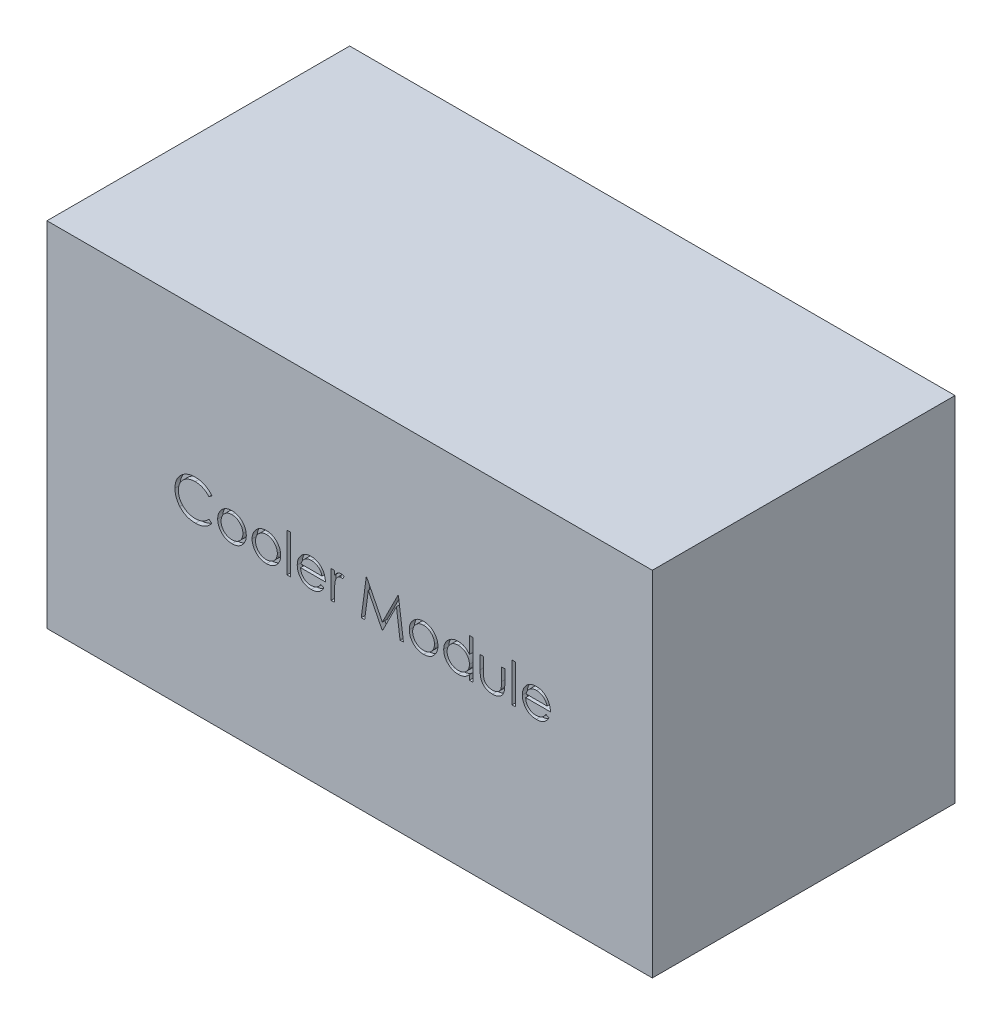
from build123d import *

# Parameters (mm, degrees)
SKETCH1_W           = 304.8
SKETCH1_H           = 177.8
BOSS_EXTRUDE1_DEPTH = 76.2
SKETCH2_W           = 1.709615385
SKETCH2_H           = 19.538461538
CUT_EXTRUDE1_DEPTH  = 2.54


with BuildPart() as part:
    # Sketch1 → Boss-Extrude1 (new, symmetric)
    with BuildSketch(Plane.XY):
        Rectangle(SKETCH1_W, SKETCH1_H)
    extrude(amount=BOSS_EXTRUDE1_DEPTH, both=True)

    # Sketch2 → Cut-Extrude1 (cut)
    # profile 1 of 12: a face of its own
    with BuildSketch(Plane.XY.offset(76.2)):
        with BuildLine():
            Line((-69.387672667, 10.444990481), (-70.883586129, 9.30015875))
            add(Edge.make_bspline(
                [(-70.883586129, 9.30015875), (-70.990298178, 9.427336386), (-71.202283568, 9.679977027), (-71.543328656, 10.034739977), (-71.898756169, 10.367109471), (-72.268430243, 10.678668844), (-72.659004879, 10.958522955), (-73.061018655, 11.221255672), (-73.481196587, 11.456755789), (-74.062231028, 11.742304328), (-74.822314316, 12.040279828), (-75.779140512, 12.290124559), (-76.777965205, 12.449171244), (-77.459397855, 12.466397024), (-77.806001994, 12.47515875)],
                knots=[0, 0, 0, 0, 0.757959112, 1.505699292, 2.245454638, 2.979532153, 3.711538275, 4.438200793, 5.171680507, 5.909471876, 7.393775596, 8.890124382, 10.418191784, 12, 12, 12, 12], degree=3))
            add(Edge.make_bspline(
                [(-77.806001994, 12.47515875), (-77.996955381, 12.47296004), (-78.377089926, 12.468583026), (-78.94123376, 12.410839073), (-79.494843367, 12.329679487), (-80.037558633, 12.209254513), (-80.568688736, 12.057003544), (-81.091705953, 11.875073791), (-81.599037932, 11.649985305), (-82.097702914, 11.401201776), (-82.57547262, 11.12020097), (-83.02752938, 10.81369544), (-83.452224463, 10.485115072), (-83.849893823, 10.133228336), (-84.220943999, 9.759619951), (-84.562686362, 9.360308321), (-84.873938381, 8.936570062), (-85.160869617, 8.493992801), (-85.41784178, 8.033865678), (-85.632997266, 7.554485651), (-85.823525146, 7.064061891), (-85.974288167, 6.55705343), (-86.09362018, 6.037027804), (-86.17595789, 5.502589373), (-86.23304514, 4.954854631), (-86.237400389, 4.583601086), (-86.239595744, 4.396462837)],
                knots=[0, 0, 0, 0, 1.054917814, 2.100044995, 3.131103042, 4.146048494, 5.169673617, 6.183595914, 7.203665975, 8.234915748, 9.262203917, 10.264457458, 11.251630812, 12.227803204, 13.197192746, 14.159520551, 15.12972552, 16.100847026, 17.073214652, 18.039054194, 19.002613845, 19.979014051, 20.95965708, 21.949030935, 22.966165397, 24, 24, 24, 24], degree=3))
            add(Edge.make_bspline(
                [(-86.239595744, 4.396462837), (-86.232727844, 4.114896653), (-86.219243632, 3.562078798), (-86.099237699, 2.752341618), (-85.916874274, 1.97662195), (-85.643558062, 1.239768809), (-85.306541515, 0.532696174), (-84.880689044, -0.132632442), (-84.387476176, -0.766271172), (-83.819925408, -1.35324493), (-83.197230895, -1.889441064), (-82.529131548, -2.361612086), (-81.817291353, -2.755211661), (-81.06956998, -3.082740741), (-80.28021356, -3.334509501), (-79.450641564, -3.511751374), (-78.582658275, -3.627369528), (-77.989553399, -3.638438601), (-77.687702715, -3.644072019)],
                knots=[0, 0, 0, 0, 1.029171465, 2.020641659, 2.987623507, 3.938342917, 4.889210282, 5.84687017, 6.821220943, 7.821438502, 8.827599549, 9.822697543, 10.807740252, 11.797342354, 12.80366471, 13.83203677, 14.896651826, 16, 16, 16, 16], degree=3))
            add(Edge.make_bspline(
                [(-77.687702715, -3.644072019), (-77.355129508, -3.634880232), (-76.700545878, -3.616788596), (-75.740599906, -3.463521826), (-74.821650953, -3.215012302), (-73.94364959, -2.867225039), (-73.109071015, -2.415112544), (-72.316609193, -1.867028382), (-71.565595216, -1.217759028), (-71.11399438, -0.722006573), (-70.883586129, -0.469072019)],
                knots=[0, 0, 0, 0, 1.028121516, 2.023589091, 2.998037872, 3.967518031, 4.937445131, 5.927275754, 6.942489185, 8, 8, 8, 8], degree=3))
            Line((-70.883586129, -0.469072019), (-69.387672667, -1.602455432))
            add(Edge.make_bspline(
                [(-69.387672667, -1.602455432), (-69.50805838, -1.757786149), (-69.748253164, -2.067703558), (-70.137188942, -2.504611006), (-70.546912518, -2.915568685), (-70.980467168, -3.297263309), (-71.432865434, -3.657332615), (-71.912230448, -3.985546868), (-72.412260468, -4.286487253), (-72.931261274, -4.56204237), (-73.468681438, -4.806520529), (-74.023877006, -5.015818894), (-74.594454852, -5.196112935), (-75.180441062, -5.344441334), (-75.78305111, -5.460216805), (-76.400110405, -5.537612463), (-77.032950726, -5.590636312), (-77.459896175, -5.595469111), (-77.676254398, -5.597918173)],
                knots=[0, 0, 0, 0, 0.986787822, 1.968848986, 2.935600012, 3.899624008, 4.868462664, 5.837806735, 6.815139263, 7.798259679, 8.787526145, 9.778297419, 10.776456485, 11.791383307, 12.812564526, 13.85620153, 14.913611965, 16, 16, 16, 16], degree=3))
            add(Edge.make_bspline(
                [(-77.676254398, -5.597918173), (-77.8811435, -5.596492185), (-78.286286328, -5.59367247), (-78.884449533, -5.547995102), (-79.466778537, -5.485675819), (-80.031609001, -5.391840249), (-80.582023236, -5.281108912), (-81.113031561, -5.132675358), (-81.629859205, -4.966400609), (-82.130429746, -4.770974895), (-82.615168969, -4.550451102), (-83.082513428, -4.301214188), (-83.532248181, -4.025360039), (-83.968794829, -3.728969197), (-84.385704534, -3.402521311), (-84.786590151, -3.050550057), (-85.173699629, -2.674241742), (-85.413199957, -2.402888897), (-85.533616177, -2.266457836)],
                knots=[0, 0, 0, 0, 1.114604814, 2.203992996, 3.262667896, 4.300477797, 5.318619304, 6.316056647, 7.298880507, 8.271930387, 9.238335007, 10.195173496, 11.151986948, 12.108099108, 13.064862484, 14.031167946, 15.010108607, 16, 16, 16, 16], degree=3))
            add(Edge.make_bspline(
                [(-85.533616177, -2.266457836), (-85.726487322, -2.029469365), (-86.109901103, -1.558353556), (-86.600442324, -0.794797001), (-87.020345446, 0.002408536), (-87.359848672, 0.837451292), (-87.625257262, 1.708457499), (-87.809123481, 2.615866228), (-87.928602928, 3.558830027), (-87.942266072, 4.200198834), (-87.949211129, 4.526210433)],
                knots=[0, 0, 0, 0, 0.994628077, 1.977248131, 2.950237994, 3.925870899, 4.908910175, 5.911660606, 6.938484602, 8, 8, 8, 8], degree=3))
            add(Edge.make_bspline(
                [(-87.949211129, 4.526210433), (-87.940746433, 4.868867973), (-87.924092671, 5.543025291), (-87.78260127, 6.532394951), (-87.554987536, 7.480276136), (-87.231698757, 8.384899375), (-86.821822488, 9.251022757), (-86.315491918, 10.072029886), (-85.71858933, 10.853171324), (-85.03579614, 11.582594471), (-84.287036786, 12.249558661), (-83.485201528, 12.836332428), (-82.631859788, 13.32465205), (-81.736412624, 13.732845449), (-80.792154843, 14.046596027), (-79.801101076, 14.266232657), (-78.765113555, 14.402941533), (-78.058290924, 14.420223736), (-77.699151033, 14.429004904)],
                knots=[0, 0, 0, 0, 1.032925535, 2.032216505, 3.007276963, 3.968222605, 4.92396291, 5.891752235, 6.871517503, 7.883894988, 8.900124299, 9.891468569, 10.874487609, 11.85992873, 12.854644235, 13.869047385, 14.917252991, 16, 16, 16, 16], degree=3))
            add(Edge.make_bspline(
                [(-77.699151033, 14.429004904), (-77.480269407, 14.426380695), (-77.047015272, 14.421186337), (-76.406104406, 14.370534335), (-75.782122598, 14.286095992), (-75.174639968, 14.171164241), (-74.580701156, 14.028521534), (-74.00484556, 13.842700767), (-73.443694135, 13.630230504), (-72.900785964, 13.385527997), (-72.378725884, 13.110844733), (-71.877676493, 12.80922541), (-71.401617762, 12.481043955), (-70.947199887, 12.129091528), (-70.52202451, 11.745922227), (-70.114019891, 11.342075312), (-69.737041737, 10.905918355), (-69.504342204, 10.598914357), (-69.387672667, 10.444990481)],
                knots=[0, 0, 0, 0, 1.096760587, 2.17092713, 3.219439832, 4.250915756, 5.268269357, 6.278326846, 7.281116186, 8.274029601, 9.260640565, 10.235837813, 11.203064059, 12.156899882, 13.114053108, 14.069676657, 15.032185724, 16, 16, 16, 16], degree=3))
        make_face()
    # profile 2 of 12: a face of its own
    with BuildSketch(Plane.XY.offset(76.2)):
        with BuildLine():
            add(Edge.make_bspline(
                [(-59.244463533, 9.055927981), (-58.983253891, 9.050365974), (-58.471085619, 9.039460236), (-57.721016983, 8.922901637), (-57.0050356, 8.744662411), (-56.320399325, 8.498255766), (-55.675876346, 8.167972578), (-55.062078574, 7.773859151), (-54.480688855, 7.306956749), (-54.132220653, 6.945779262), (-53.955340937, 6.762448414)],
                knots=[0, 0, 0, 0, 1.054011418, 2.066658804, 3.057071809, 4.030435133, 4.997543892, 5.974964718, 6.972108034, 8, 8, 8, 8], degree=3))
            add(Edge.make_bspline(
                [(-53.955340937, 6.762448414), (-53.803039158, 6.587112291), (-53.50138306, 6.239833283), (-53.114582505, 5.676739161), (-52.781362299, 5.093590899), (-52.514319611, 4.482644735), (-52.303762554, 3.849234025), (-52.154270693, 3.19118165), (-52.06535109, 2.509940875), (-52.053360655, 2.047277128), (-52.047288052, 1.812959231)],
                knots=[0, 0, 0, 0, 1.025258237, 2.030674902, 3.01204498, 3.988269485, 4.97094183, 5.956517959, 6.965070386, 8, 8, 8, 8], degree=3))
            add(Edge.make_bspline(
                [(-52.047288052, 1.812959231), (-52.052629331, 1.577283203), (-52.063183947, 1.11157638), (-52.16302563, 0.425670975), (-52.318316255, -0.239417989), (-52.540558117, -0.880906022), (-52.825535826, -1.500753982), (-53.173283711, -2.096254529), (-53.586242084, -2.668582569), (-54.054349553, -3.212878289), (-54.571703336, -3.714525829), (-55.1329498, -4.151741125), (-55.727059612, -4.52632685), (-56.361932721, -4.828059341), (-57.031771471, -5.065964996), (-57.738020656, -5.233060799), (-58.47958311, -5.334089392), (-58.985916986, -5.347062841), (-59.244463533, -5.353687404)],
                knots=[0, 0, 0, 0, 0.998656419, 1.973391657, 2.932242238, 3.890759089, 4.846373663, 5.82037756, 6.809684879, 7.83454468, 8.860553229, 9.859544525, 10.845671541, 11.83227036, 12.833544569, 13.85385346, 14.904124723, 16, 16, 16, 16], degree=3))
            add(Edge.make_bspline(
                [(-59.244463533, -5.353687404), (-59.504276792, -5.347040607), (-60.013134185, -5.33402252), (-60.757314173, -5.23345331), (-61.464829099, -5.066042005), (-62.135544756, -4.827277509), (-62.773147423, -4.526317206), (-63.370699642, -4.152873581), (-63.93240204, -3.714396165), (-64.449865269, -3.212913422), (-64.917943393, -2.668573517), (-65.330909338, -2.096256879), (-65.678655256, -1.50075337), (-65.96363348, -0.880906185), (-66.185875205, -0.239417945), (-66.341165866, 0.425670963), (-66.44100754, 1.111576383), (-66.451562157, 1.577283204), (-66.456903437, 1.812959231)],
                knots=[0, 0, 0, 0, 1.099876186, 2.154163076, 3.173186993, 4.173200201, 5.163417411, 6.152872554, 7.150605724, 8.17532212, 9.198891216, 10.186952605, 11.159729845, 12.11414092, 13.071450619, 14.029093627, 15.002601286, 16, 16, 16, 16], degree=3))
            add(Edge.make_bspline(
                [(-66.456903437, 1.812959231), (-66.450789419, 2.046003574), (-66.438684714, 2.507391321), (-66.349854515, 3.187351466), (-66.2009458, 3.844290112), (-65.990136343, 4.475255917), (-65.720632232, 5.08352479), (-65.392094365, 5.668113942), (-65.001348208, 6.228661827), (-64.700891872, 6.575492005), (-64.548850552, 6.751000096)],
                knots=[0, 0, 0, 0, 1.031353054, 2.041901799, 3.029428768, 4.008703097, 4.981709435, 5.96992636, 6.972712378, 8, 8, 8, 8], degree=3))
            add(Edge.make_bspline(
                [(-64.548850552, 6.751000096), (-64.372237507, 6.935920837), (-64.024896876, 7.299600012), (-63.440613087, 7.765141322), (-62.828325289, 8.167455953), (-62.17667962, 8.491176497), (-61.492605778, 8.746111857), (-60.77295533, 8.923361304), (-60.020341453, 9.039040279), (-59.505666944, 9.050242647), (-59.244463533, 9.055927981)],
                knots=[0, 0, 0, 0, 1.027980169, 2.021703884, 2.998553061, 3.971491411, 4.943284454, 5.930300938, 6.949603206, 8, 8, 8, 8], degree=3))
        make_face()
        with BuildLine():
            add(Edge.make_bspline(
                [(-59.252095744, 7.346312596), (-59.436813315, 7.341062462), (-59.801480001, 7.330697724), (-60.338252312, 7.2518639), (-60.854998007, 7.126963913), (-61.352697458, 6.949504693), (-61.829672297, 6.7203664), (-62.286379187, 6.438925182), (-62.724161467, 6.108908662), (-63.134455269, 5.730833264), (-63.511004711, 5.317834736), (-63.840177698, 4.877788669), (-64.120077205, 4.417832698), (-64.35325007, 3.93748852), (-64.526916337, 3.431888382), (-64.653043788, 2.906758089), (-64.73180324, 2.361027751), (-64.742070529, 1.990037065), (-64.747288052, 1.801510914)],
                knots=[0, 0, 0, 0, 1.021534396, 2.016698045, 2.994645724, 3.958388632, 4.93408049, 5.916473867, 6.921342795, 7.962252576, 8.998418191, 10.008913653, 10.997312074, 11.973003931, 12.956656626, 13.948281152, 14.957379055, 16, 16, 16, 16], degree=3))
            add(Edge.make_bspline(
                [(-64.747288052, 1.801510914), (-64.738542341, 1.557932023), (-64.721183739, 1.074473473), (-64.580021952, 0.36248722), (-64.343876628, -0.321036861), (-64.024994435, -0.972091762), (-63.625454873, -1.574465161), (-63.154718124, -2.111519955), (-62.617836327, -2.575174157), (-62.021209375, -2.959879902), (-61.377023731, -3.265549429), (-60.695271469, -3.482169569), (-59.984212834, -3.622985494), (-59.498270569, -3.636981662), (-59.252095744, -3.644072019)],
                knots=[0, 0, 0, 0, 1.016792936, 2.018143844, 3.017858371, 4.030088057, 5.03801393, 6.028138512, 7.003788237, 7.991172063, 8.984598303, 9.972568034, 10.972917682, 12, 12, 12, 12], degree=3))
            add(Edge.make_bspline(
                [(-59.252095744, -3.644072019), (-59.005935079, -3.636940351), (-58.520020764, -3.622862635), (-57.809950101, -3.482878774), (-57.130061197, -3.264600278), (-56.486544645, -2.960223678), (-55.890189275, -2.573713249), (-55.349446201, -2.114138111), (-54.88272876, -1.57304272), (-54.483584425, -0.971293885), (-54.159480011, -0.322046197), (-53.924440012, 0.362613374), (-53.782938866, 1.074441345), (-53.76562607, 1.557921259), (-53.756903437, 1.801510914)],
                knots=[0, 0, 0, 0, 1.02726834, 2.027799167, 3.010890988, 4.004497153, 4.992059811, 5.971914811, 6.958719428, 7.966827853, 8.981595046, 9.981490638, 10.983022906, 12, 12, 12, 12], degree=3))
            add(Edge.make_bspline(
                [(-53.756903437, 1.801510914), (-53.762119164, 1.990038192), (-53.772382918, 2.361031095), (-53.851168081, 2.906745306), (-53.977200375, 3.431935282), (-54.151217321, 3.937315472), (-54.383377025, 4.419076388), (-54.668674141, 4.876438188), (-54.996503008, 5.319359103), (-55.377596195, 5.729498205), (-55.787461723, 6.109056047), (-56.225421431, 6.439053152), (-56.6814511, 6.719129493), (-57.157040243, 6.951464603), (-57.654803504, 7.125349412), (-58.170825164, 7.252585078), (-58.705307258, 7.330364577), (-59.068667193, 7.34096259), (-59.252095744, 7.346312596)],
                knots=[0, 0, 0, 0, 1.042956736, 2.052379634, 3.044323526, 4.02829302, 5.004299113, 5.996692471, 7.007513377, 8.048758398, 9.090003419, 10.095195979, 11.07790575, 12.047570684, 13.018257071, 13.989683339, 14.985167495, 16, 16, 16, 16], degree=3))
        make_face(mode=Mode.SUBTRACT)
    # profile 3 of 12: a face of its own
    with BuildSketch(Plane.XY.offset(76.2)):
        with BuildLine():
            add(Edge.make_bspline(
                [(-41.904078917, 9.055927981), (-41.642869275, 9.050365974), (-41.130701003, 9.039460236), (-40.380632367, 8.922901637), (-39.664650985, 8.744662411), (-38.98001471, 8.498255766), (-38.335491731, 8.167972578), (-37.721693959, 7.773859151), (-37.140304239, 7.306956749), (-36.791836037, 6.945779262), (-36.614956321, 6.762448414)],
                knots=[0, 0, 0, 0, 1.054011418, 2.066658804, 3.057071809, 4.030435133, 4.997543892, 5.974964718, 6.972108034, 8, 8, 8, 8], degree=3))
            add(Edge.make_bspline(
                [(-36.614956321, 6.762448414), (-36.462654543, 6.587112291), (-36.160998445, 6.239833283), (-35.774197889, 5.676739161), (-35.440977683, 5.093590899), (-35.173934996, 4.482644735), (-34.963377938, 3.849234025), (-34.813886077, 3.19118165), (-34.724966474, 2.509940875), (-34.71297604, 2.047277128), (-34.706903437, 1.812959231)],
                knots=[0, 0, 0, 0, 1.025258237, 2.030674902, 3.01204498, 3.988269485, 4.97094183, 5.956517959, 6.965070386, 8, 8, 8, 8], degree=3))
            add(Edge.make_bspline(
                [(-34.706903437, 1.812959231), (-34.712244715, 1.577283203), (-34.722799332, 1.11157638), (-34.822641015, 0.425670975), (-34.97793164, -0.239417989), (-35.200173502, -0.880906022), (-35.485151211, -1.500753982), (-35.832899096, -2.096254529), (-36.245857469, -2.668582569), (-36.713964937, -3.212878289), (-37.23131872, -3.714525829), (-37.792565185, -4.151741125), (-38.386674997, -4.52632685), (-39.021548105, -4.828059341), (-39.691386855, -5.065964996), (-40.39763604, -5.233060799), (-41.139198494, -5.334089392), (-41.645532371, -5.347062841), (-41.904078917, -5.353687404)],
                knots=[0, 0, 0, 0, 0.998656419, 1.973391657, 2.932242238, 3.890759089, 4.846373663, 5.82037756, 6.809684879, 7.83454468, 8.860553229, 9.859544525, 10.845671541, 11.83227036, 12.833544569, 13.85385346, 14.904124723, 16, 16, 16, 16], degree=3))
            add(Edge.make_bspline(
                [(-41.904078917, -5.353687404), (-42.163892176, -5.347040607), (-42.67274957, -5.33402252), (-43.416929557, -5.23345331), (-44.124444483, -5.066042005), (-44.795160141, -4.827277509), (-45.432762808, -4.526317206), (-46.030315027, -4.152873581), (-46.592017424, -3.714396165), (-47.109480654, -3.212913422), (-47.577558777, -2.668573517), (-47.990524723, -2.096256879), (-48.338270641, -1.50075337), (-48.623248865, -0.880906185), (-48.845490589, -0.239417945), (-49.000781251, 0.425670963), (-49.100622924, 1.111576383), (-49.111177542, 1.577283204), (-49.116518821, 1.812959231)],
                knots=[0, 0, 0, 0, 1.099876186, 2.154163076, 3.173186993, 4.173200201, 5.163417411, 6.152872554, 7.150605724, 8.17532212, 9.198891216, 10.186952605, 11.159729845, 12.11414092, 13.071450619, 14.029093627, 15.002601286, 16, 16, 16, 16], degree=3))
            add(Edge.make_bspline(
                [(-49.116518821, 1.812959231), (-49.110404803, 2.046003574), (-49.098300099, 2.507391321), (-49.0094699, 3.187351466), (-48.860561185, 3.844290112), (-48.649751727, 4.475255917), (-48.380247617, 5.08352479), (-48.05170975, 5.668113942), (-47.660963592, 6.228661827), (-47.360507256, 6.575492005), (-47.208465937, 6.751000096)],
                knots=[0, 0, 0, 0, 1.031353054, 2.041901799, 3.029428768, 4.008703097, 4.981709435, 5.96992636, 6.972712378, 8, 8, 8, 8], degree=3))
            add(Edge.make_bspline(
                [(-47.208465937, 6.751000096), (-47.031852891, 6.935920837), (-46.684512261, 7.299600012), (-46.100228471, 7.765141322), (-45.487940674, 8.167455953), (-44.836295004, 8.491176497), (-44.152221163, 8.746111857), (-43.432570714, 8.923361304), (-42.679956837, 9.039040279), (-42.165282328, 9.050242647), (-41.904078917, 9.055927981)],
                knots=[0, 0, 0, 0, 1.027980169, 2.021703884, 2.998553061, 3.971491411, 4.943284454, 5.930300938, 6.949603206, 8, 8, 8, 8], degree=3))
        make_face()
        with BuildLine():
            add(Edge.make_bspline(
                [(-41.911711129, 7.346312596), (-42.096428699, 7.341062462), (-42.461095385, 7.330697724), (-42.997867696, 7.2518639), (-43.514613391, 7.126963913), (-44.012312843, 6.949504693), (-44.489287681, 6.7203664), (-44.945994572, 6.438925182), (-45.383776852, 6.108908662), (-45.794070654, 5.730833264), (-46.170620095, 5.317834736), (-46.499793082, 4.877788669), (-46.77969259, 4.417832698), (-47.012865455, 3.93748852), (-47.186531722, 3.431888382), (-47.312659173, 2.906758089), (-47.391418624, 2.361027751), (-47.401685913, 1.990037065), (-47.406903437, 1.801510914)],
                knots=[0, 0, 0, 0, 1.021534396, 2.016698045, 2.994645724, 3.958388632, 4.93408049, 5.916473867, 6.921342795, 7.962252576, 8.998418191, 10.008913653, 10.997312074, 11.973003931, 12.956656626, 13.948281152, 14.957379055, 16, 16, 16, 16], degree=3))
            add(Edge.make_bspline(
                [(-47.406903437, 1.801510914), (-47.398157725, 1.557932023), (-47.380799123, 1.074473473), (-47.239637336, 0.36248722), (-47.003492013, -0.321036861), (-46.684609819, -0.972091762), (-46.285070257, -1.574465161), (-45.814333509, -2.111519955), (-45.277451711, -2.575174157), (-44.68082476, -2.959879902), (-44.036639115, -3.265549429), (-43.354886853, -3.482169569), (-42.643828219, -3.622985494), (-42.157885953, -3.636981662), (-41.911711129, -3.644072019)],
                knots=[0, 0, 0, 0, 1.016792936, 2.018143844, 3.017858371, 4.030088057, 5.03801393, 6.028138512, 7.003788237, 7.991172063, 8.984598303, 9.972568034, 10.972917682, 12, 12, 12, 12], degree=3))
            add(Edge.make_bspline(
                [(-41.911711129, -3.644072019), (-41.665550464, -3.636940351), (-41.179636149, -3.622862635), (-40.469565486, -3.482878774), (-39.789676582, -3.264600278), (-39.14616003, -2.960223678), (-38.54980466, -2.573713249), (-38.009061585, -2.114138111), (-37.542344145, -1.57304272), (-37.143199809, -0.971293885), (-36.819095395, -0.322046197), (-36.584055397, 0.362613374), (-36.442554251, 1.074441345), (-36.425241455, 1.557921259), (-36.416518821, 1.801510914)],
                knots=[0, 0, 0, 0, 1.02726834, 2.027799167, 3.010890988, 4.004497153, 4.992059811, 5.971914811, 6.958719428, 7.966827853, 8.981595046, 9.981490638, 10.983022906, 12, 12, 12, 12], degree=3))
            add(Edge.make_bspline(
                [(-36.416518821, 1.801510914), (-36.421734548, 1.990038192), (-36.431998302, 2.361031095), (-36.510783466, 2.906745306), (-36.63681576, 3.431935282), (-36.810832705, 3.937315472), (-37.042992409, 4.419076388), (-37.328289526, 4.876438188), (-37.656118393, 5.319359103), (-38.037211579, 5.729498205), (-38.447077108, 6.109056047), (-38.885036815, 6.439053152), (-39.341066485, 6.719129493), (-39.816655627, 6.951464603), (-40.314418888, 7.125349412), (-40.830440549, 7.252585078), (-41.364922643, 7.330364577), (-41.728282578, 7.34096259), (-41.911711129, 7.346312596)],
                knots=[0, 0, 0, 0, 1.042956736, 2.052379634, 3.044323526, 4.02829302, 5.004299113, 5.996692471, 7.007513377, 8.048758398, 9.090003419, 10.095195979, 11.07790575, 12.047570684, 13.018257071, 13.989683339, 14.985167495, 16, 16, 16, 16], degree=3))
        make_face(mode=Mode.SUBTRACT)
    # profile 4 of 12: a face of its own
    with BuildSketch(Plane.XY.offset(76.2)):
        with Locations((-30.677095745, 4.659774135)):
            Rectangle(SKETCH2_W, SKETCH2_H)
    # profile 5 of 12: a face of its own
    with BuildSketch(Plane.XY.offset(76.2)):
        with BuildLine():
            Line((-14.489175071, -0.713302788), (-12.970364975, -1.510868894))
            add(Edge.make_bspline(
                [(-12.970364975, -1.510868894), (-13.091395586, -1.725553311), (-13.326873227, -2.143244171), (-13.731825869, -2.717094726), (-14.156325578, -3.233337293), (-14.619534318, -3.678180126), (-15.107593571, -4.065991236), (-15.623209878, -4.40528711), (-16.169067586, -4.694403628), (-16.745192516, -4.937985244), (-17.35642293, -5.125271205), (-18.004240041, -5.257555607), (-18.689884894, -5.339325112), (-19.159854816, -5.348823664), (-19.400503196, -5.353687404)],
                knots=[0, 0, 0, 0, 1.120438281, 2.179929193, 3.190490725, 4.156257408, 5.095198341, 6.022838206, 6.959905092, 7.901321166, 8.864066838, 9.862729781, 10.905609505, 12, 12, 12, 12], degree=3))
            add(Edge.make_bspline(
                [(-19.400503196, -5.353687404), (-19.66797596, -5.347443492), (-20.189737834, -5.33526343), (-20.949232743, -5.230257302), (-21.664312149, -5.05895775), (-22.334935849, -4.819659588), (-22.959461538, -4.507090867), (-23.539130476, -4.126311402), (-24.076991038, -3.679277273), (-24.556094234, -3.162116344), (-24.987407367, -2.608675977), (-25.368003616, -2.031973234), (-25.686179062, -1.433459112), (-25.945001126, -0.816943832), (-26.15403332, -0.186313211), (-26.299720664, 0.464170634), (-26.383702578, 1.132747171), (-26.396571918, 1.585034098), (-26.403057283, 1.812959231)],
                knots=[0, 0, 0, 0, 1.145258523, 2.234067595, 3.276747158, 4.290159414, 5.277019952, 6.260822364, 7.254936242, 8.264827045, 9.274100331, 10.257902744, 11.220704747, 12.172965371, 13.118907548, 14.062713208, 15.023725156, 16, 16, 16, 16], degree=3))
            add(Edge.make_bspline(
                [(-26.403057283, 1.812959231), (-26.397292528, 2.026835379), (-26.385867545, 2.450709662), (-26.313854259, 3.078083554), (-26.18622855, 3.687838417), (-26.011097415, 4.280480912), (-25.784939918, 4.855018756), (-25.508267411, 5.411801616), (-25.180648897, 5.950237021), (-24.927704773, 6.289888363), (-24.80029286, 6.460976058)],
                knots=[0, 0, 0, 0, 1.024358464, 2.0301432, 3.019427413, 4.004406732, 4.986367066, 5.972626655, 6.978780325, 8, 8, 8, 8], degree=3))
            add(Edge.make_bspline(
                [(-24.80029286, 6.460976058), (-24.627712472, 6.667090908), (-24.288018606, 7.072791413), (-23.713490443, 7.605855729), (-23.091370803, 8.052408276), (-22.429456095, 8.422561403), (-21.720053286, 8.703813682), (-20.972698431, 8.913404951), (-20.17888174, 9.030850982), (-19.636200466, 9.047439905), (-19.358526033, 9.055927981)],
                knots=[0, 0, 0, 0, 1.030682036, 2.02871468, 2.997146059, 3.962720338, 4.930598197, 5.918074684, 6.934738563, 8, 8, 8, 8], degree=3))
            add(Edge.make_bspline(
                [(-19.358526033, 9.055927981), (-19.07306121, 9.048558086), (-18.5130443, 9.034100033), (-17.696440898, 8.900062418), (-16.923768998, 8.687504943), (-16.195337796, 8.38731074), (-15.51107344, 7.999999465), (-14.875423655, 7.520256014), (-14.277517566, 6.962808996), (-13.929672301, 6.534112099), (-13.752666658, 6.315964039)],
                knots=[0, 0, 0, 0, 1.056321875, 2.072262726, 3.055038591, 4.01806755, 4.982017516, 5.957941055, 6.960871419, 8, 8, 8, 8], degree=3))
            add(Edge.make_bspline(
                [(-13.752666658, 6.315964039), (-13.632232894, 6.15157026), (-13.392167008, 5.823876957), (-13.091464935, 5.289545373), (-12.830439685, 4.730506281), (-12.621798855, 4.137723093), (-12.452855284, 3.518219378), (-12.330626028, 2.867566384), (-12.258945675, 2.185957867), (-12.244855765, 1.721537615), (-12.237672667, 1.484774135)],
                knots=[0, 0, 0, 0, 0.94817472, 1.890038105, 2.849395472, 3.817997239, 4.812318967, 5.836947057, 6.897266129, 8, 8, 8, 8], degree=3))
            Line((-12.237672667, 1.484774135), (-24.693441898, 1.484774135))
            add(Edge.make_bspline(
                [(-24.693441898, 1.484774135), (-24.68506204, 1.301347322), (-24.668583388, 0.940645893), (-24.59175668, 0.412847774), (-24.470659783, -0.089927131), (-24.300466742, -0.563907688), (-24.094362913, -1.015284525), (-23.841892083, -1.440709326), (-23.540686796, -1.838244346), (-23.204722632, -2.21144548), (-22.830759728, -2.54379048), (-22.437335061, -2.841252291), (-22.018814371, -3.09056561), (-21.57849766, -3.292930439), (-21.117096943, -3.451351959), (-20.634466853, -3.559489669), (-20.131557105, -3.63191835), (-19.788734753, -3.639971957), (-19.614205119, -3.644072019)],
                knots=[0, 0, 0, 0, 1.094153842, 2.151609401, 3.174256925, 4.172055639, 5.149267565, 6.128595816, 7.11444997, 8.118368179, 9.117203808, 10.09244225, 11.054858984, 12.015122123, 12.976791628, 13.957293641, 14.960065497, 16, 16, 16, 16], degree=3))
            add(Edge.make_bspline(
                [(-19.614205119, -3.644072019), (-19.443565302, -3.640762453), (-19.10498317, -3.634195641), (-18.600752218, -3.570340525), (-18.10469279, -3.467088025), (-17.618858009, -3.326172508), (-17.15310812, -3.154304213), (-16.721785911, -2.946915802), (-16.325109309, -2.717500752), (-15.954358391, -2.455102378), (-15.594743413, -2.133929245), (-15.238005023, -1.733140535), (-14.855499238, -1.259135563), (-14.616070169, -0.902379867), (-14.489175071, -0.713302788)],
                knots=[0, 0, 0, 0, 0.99110716, 1.966546729, 2.947904876, 3.932708344, 4.903319531, 5.828989031, 6.710028674, 7.56322171, 8.463672341, 9.504779593, 10.677557249, 12, 12, 12, 12], degree=3))
        make_face()
        with BuildLine():
            add(Edge.make_bspline(
                [(-13.947288052, 3.19438952), (-14.009862537, 3.421154589), (-14.130298278, 3.857604353), (-14.381956205, 4.461984056), (-14.665374162, 4.999128203), (-15.000772443, 5.46492592), (-15.380785792, 5.878602184), (-15.819726, 6.240109055), (-16.311955649, 6.563509753), (-16.854930401, 6.836482643), (-17.429923545, 7.068837445), (-18.031937247, 7.224639861), (-18.646206064, 7.331371798), (-19.06168268, 7.341311045), (-19.2707556, 7.346312596)],
                knots=[0, 0, 0, 0, 1.154881502, 2.222775134, 3.210006277, 4.132804581, 5.035138423, 5.962687519, 6.919655026, 7.923214229, 8.944639381, 9.960483929, 10.97369054, 12, 12, 12, 12], degree=3))
            add(Edge.make_bspline(
                [(-19.2707556, 7.346312596), (-19.441386115, 7.342983356), (-19.778686771, 7.336402146), (-20.275625442, 7.273971871), (-20.752853518, 7.170776144), (-21.213892297, 7.029452594), (-21.652700167, 6.841082915), (-22.078303119, 6.62019421), (-22.479879276, 6.350546447), (-22.731019756, 6.145030394), (-22.857895023, 6.041204423)],
                knots=[0, 0, 0, 0, 1.04873581, 2.073130211, 3.073294108, 4.04793562, 5.032784715, 6.005352987, 6.992311501, 8, 8, 8, 8], degree=3))
            add(Edge.make_bspline(
                [(-22.857895023, 6.041204423), (-22.948754172, 5.95904822), (-23.132630946, 5.792784087), (-23.378324355, 5.506330834), (-23.613567214, 5.197440188), (-23.827654667, 4.854294582), (-24.024019816, 4.480801484), (-24.207770549, 4.080111213), (-24.373159449, 3.649183175), (-24.466211133, 3.34888747), (-24.514084927, 3.19438952)],
                knots=[0, 0, 0, 0, 0.879870761, 1.780643979, 2.707998968, 3.669668524, 4.684282772, 5.740141944, 6.837334558, 8, 8, 8, 8], degree=3))
            Line((-24.514084927, 3.19438952), (-13.947288052, 3.19438952))
        make_face(mode=Mode.SUBTRACT)
    # profile 6 of 12: a face of its own
    with BuildSketch(Plane.XY.offset(76.2)):
        with BuildLine():
            Line((-9.306903437, 8.811697212), (-7.597288052, 8.811697212))
            Line((-7.597288052, 8.811697212), (-7.597288052, 6.762448414))
            add(Edge.make_bspline(
                [(-7.597288052, 6.762448414), (-7.471074951, 6.953252279), (-7.229693375, 7.31816319), (-6.828484431, 7.800777528), (-6.417530585, 8.200365139), (-5.994864495, 8.518791434), (-5.557377979, 8.757259981), (-5.114672571, 8.931937786), (-4.659783228, 9.035228601), (-4.354101897, 9.049018945), (-4.200953917, 9.055927981)],
                knots=[0, 0, 0, 0, 1.2804753, 2.448899062, 3.506932113, 4.484331642, 5.4025378, 6.288909075, 7.142734305, 8, 8, 8, 8], degree=3))
            add(Edge.make_bspline(
                [(-4.200953917, 9.055927981), (-4.08215634, 9.049448115), (-3.837722605, 9.036115369), (-3.467703081, 8.942439309), (-3.086466578, 8.792880358), (-2.840763013, 8.652235717), (-2.712672667, 8.57891476)],
                knots=[0, 0, 0, 0, 0.901110191, 1.854092781, 2.881294221, 4, 4, 4, 4], degree=3))
            Line((-2.712672667, 8.57891476), (-3.651434687, 7.098265721))
            add(Edge.make_bspline(
                [(-3.651434687, 7.098265721), (-3.73367093, 7.134952027), (-3.889771064, 7.204589658), (-4.118123774, 7.287005456), (-4.328660764, 7.335533512), (-4.462792132, 7.342885274), (-4.525322908, 7.346312596)],
                knots=[0, 0, 0, 0, 1.180555205, 2.24091978, 3.179933427, 4, 4, 4, 4], degree=3))
            add(Edge.make_bspline(
                [(-4.525322908, 7.346312596), (-4.662514114, 7.337168393), (-4.942344408, 7.318516869), (-5.353195755, 7.171892786), (-5.751869831, 6.934991122), (-6.068489879, 6.672258357), (-6.313648427, 6.418905345), (-6.488583083, 6.197661896), (-6.649053462, 5.949583916), (-6.802379948, 5.678912351), (-6.942077921, 5.381025618), (-7.072459763, 5.058899842), (-7.19034586, 4.712161927), (-7.257566475, 4.47059421), (-7.29199959, 4.346853462)],
                knots=[0, 0, 0, 0, 1.125678352, 2.296057538, 3.5422874, 4.923748041, 5.663163013, 6.437101912, 7.23742474, 8.08941207, 8.991984279, 9.93940061, 10.944477711, 12, 12, 12, 12], degree=3))
            add(Edge.make_bspline(
                [(-7.29199959, 4.346853462), (-7.317757332, 4.236487703), (-7.374808771, 3.992035933), (-7.430279855, 3.581924677), (-7.485086803, 3.09738162), (-7.523712683, 2.537058022), (-7.559516026, 1.902353148), (-7.579709474, 1.192300073), (-7.596599425, 0.406169976), (-7.597051546, -0.143419004), (-7.597288052, -0.430910961)],
                knots=[0, 0, 0, 0, 0.566838948, 1.255505196, 2.06880316, 3.007127437, 4.065329342, 5.249902469, 6.561414163, 8, 8, 8, 8], degree=3))
            Line((-7.597288052, -0.430910961), (-7.597288052, -5.109456634))
            Line((-7.597288052, -5.109456634), (-9.306903437, -5.109456634))
            Line((-9.306903437, -5.109456634), (-9.306903437, 8.811697212))
        make_face()
    # profile 7 of 12: a face of its own
    with BuildSketch(Plane.XY.offset(76.2)):
        Polygon((5.835404256, -5.109456634), (8.350217958, 13.940543366), (8.594448727, 13.940543366), (16.459442717, -1.690225865), (24.305356179, 13.940543366), (24.553403054, 13.940543366), (27.083481179, -5.109456634), (25.366233583, -5.109456634), (23.542135025, 8.597995289), (16.665512429, -5.109456634), (16.280085746, -5.109456634), (9.37675041, 8.628524135), (7.556467958, -5.109456634), align=None)
    # profile 8 of 12: a face of its own
    with BuildSketch(Plane.XY.offset(76.2)):
        with BuildLine():
            add(Edge.make_bspline(
                [(37.226690313, 9.055927981), (37.487899956, 9.050365974), (38.000068227, 9.039460236), (38.750136863, 8.922901637), (39.466118246, 8.744662411), (40.150754521, 8.498255766), (40.7952775, 8.167972578), (41.409075272, 7.773859151), (41.990464992, 7.306956749), (42.338933194, 6.945779262), (42.51581291, 6.762448414)],
                knots=[0, 0, 0, 0, 1.054011418, 2.066658804, 3.057071809, 4.030435133, 4.997543892, 5.974964718, 6.972108034, 8, 8, 8, 8], degree=3))
            add(Edge.make_bspline(
                [(42.51581291, 6.762448414), (42.668114688, 6.587112291), (42.969770786, 6.239833283), (43.356571341, 5.676739161), (43.689791547, 5.093590899), (43.956834235, 4.482644735), (44.167391292, 3.849234025), (44.316883154, 3.19118165), (44.405802757, 2.509940875), (44.417793191, 2.047277128), (44.423865794, 1.812959231)],
                knots=[0, 0, 0, 0, 1.025258237, 2.030674902, 3.01204498, 3.988269485, 4.97094183, 5.956517959, 6.965070386, 8, 8, 8, 8], degree=3))
            add(Edge.make_bspline(
                [(44.423865794, 1.812959231), (44.418524515, 1.577283203), (44.407969899, 1.11157638), (44.308128216, 0.425670975), (44.152837591, -0.239417989), (43.930595729, -0.880906022), (43.64561802, -1.500753982), (43.297870135, -2.096254529), (42.884911762, -2.668582569), (42.416804294, -3.212878289), (41.899450511, -3.714525829), (41.338204046, -4.151741125), (40.744094234, -4.52632685), (40.109221125, -4.828059341), (39.439382376, -5.065964996), (38.733133191, -5.233060799), (37.991570737, -5.334089392), (37.48523686, -5.347062841), (37.226690313, -5.353687404)],
                knots=[0, 0, 0, 0, 0.998656419, 1.973391657, 2.932242238, 3.890759089, 4.846373663, 5.82037756, 6.809684879, 7.83454468, 8.860553229, 9.859544525, 10.845671541, 11.83227036, 12.833544569, 13.85385346, 14.904124723, 16, 16, 16, 16], degree=3))
            add(Edge.make_bspline(
                [(37.226690313, -5.353687404), (36.966877054, -5.347040607), (36.458019661, -5.33402252), (35.713839673, -5.23345331), (35.006324747, -5.066042005), (34.33560909, -4.827277509), (33.698006423, -4.526317206), (33.100454204, -4.152873581), (32.538751806, -3.714396165), (32.021288577, -3.212913422), (31.553210454, -2.668573517), (31.140244508, -2.096256879), (30.79249859, -1.50075337), (30.507520366, -0.880906185), (30.285278642, -0.239417945), (30.12998798, 0.425670963), (30.030146306, 1.111576383), (30.019591689, 1.577283204), (30.01425041, 1.812959231)],
                knots=[0, 0, 0, 0, 1.099876186, 2.154163076, 3.173186993, 4.173200201, 5.163417411, 6.152872554, 7.150605724, 8.17532212, 9.198891216, 10.186952605, 11.159729845, 12.11414092, 13.071450619, 14.029093627, 15.002601286, 16, 16, 16, 16], degree=3))
            add(Edge.make_bspline(
                [(30.01425041, 1.812959231), (30.020364427, 2.046003574), (30.032469132, 2.507391321), (30.121299331, 3.187351466), (30.270208046, 3.844290112), (30.481017504, 4.475255917), (30.750521614, 5.08352479), (31.079059481, 5.668113942), (31.469805638, 6.228661827), (31.770261975, 6.575492005), (31.922303294, 6.751000096)],
                knots=[0, 0, 0, 0, 1.031353054, 2.041901799, 3.029428768, 4.008703097, 4.981709435, 5.96992636, 6.972712378, 8, 8, 8, 8], degree=3))
            add(Edge.make_bspline(
                [(31.922303294, 6.751000096), (32.09891634, 6.935920837), (32.44625697, 7.299600012), (33.030540759, 7.765141322), (33.642828557, 8.167455953), (34.294474227, 8.491176497), (34.978548068, 8.746111857), (35.698198516, 8.923361304), (36.450812393, 9.039040279), (36.965486902, 9.050242647), (37.226690313, 9.055927981)],
                knots=[0, 0, 0, 0, 1.027980169, 2.021703884, 2.998553061, 3.971491411, 4.943284454, 5.930300938, 6.949603206, 8, 8, 8, 8], degree=3))
        make_face()
        with BuildLine():
            add(Edge.make_bspline(
                [(37.219058102, 7.346312596), (37.034340532, 7.341062462), (36.669673846, 7.330697724), (36.132901535, 7.2518639), (35.61615584, 7.126963913), (35.118456388, 6.949504693), (34.641481549, 6.7203664), (34.184774659, 6.438925182), (33.746992379, 6.108908662), (33.336698577, 5.730833264), (32.960149135, 5.317834736), (32.630976148, 4.877788669), (32.351076641, 4.417832698), (32.117903776, 3.93748852), (31.944237509, 3.431888382), (31.818110058, 2.906758089), (31.739350607, 2.361027751), (31.729083317, 1.990037065), (31.723865794, 1.801510914)],
                knots=[0, 0, 0, 0, 1.021534396, 2.016698045, 2.994645724, 3.958388632, 4.93408049, 5.916473867, 6.921342795, 7.962252576, 8.998418191, 10.008913653, 10.997312074, 11.973003931, 12.956656626, 13.948281152, 14.957379055, 16, 16, 16, 16], degree=3))
            add(Edge.make_bspline(
                [(31.723865794, 1.801510914), (31.732611506, 1.557932023), (31.749970108, 1.074473473), (31.891131894, 0.36248722), (32.127277218, -0.321036861), (32.446159412, -0.972091762), (32.845698973, -1.574465161), (33.316435722, -2.111519955), (33.85331752, -2.575174157), (34.449944471, -2.959879902), (35.094130115, -3.265549429), (35.775882377, -3.482169569), (36.486941012, -3.622985494), (36.972883277, -3.636981662), (37.219058102, -3.644072019)],
                knots=[0, 0, 0, 0, 1.016792936, 2.018143844, 3.017858371, 4.030088057, 5.03801393, 6.028138512, 7.003788237, 7.991172063, 8.984598303, 9.972568034, 10.972917682, 12, 12, 12, 12], degree=3))
            add(Edge.make_bspline(
                [(37.219058102, -3.644072019), (37.465218767, -3.636940351), (37.951133082, -3.622862635), (38.661203745, -3.482878774), (39.341092649, -3.264600278), (39.984609201, -2.960223678), (40.580964571, -2.573713249), (41.121707646, -2.114138111), (41.588425086, -1.57304272), (41.987569421, -0.971293885), (42.311673835, -0.322046197), (42.546713834, 0.362613374), (42.68821498, 1.074441345), (42.705527776, 1.557921259), (42.71425041, 1.801510914)],
                knots=[0, 0, 0, 0, 1.02726834, 2.027799167, 3.010890988, 4.004497153, 4.992059811, 5.971914811, 6.958719428, 7.966827853, 8.981595046, 9.981490638, 10.983022906, 12, 12, 12, 12], degree=3))
            add(Edge.make_bspline(
                [(42.71425041, 1.801510914), (42.709034683, 1.990038192), (42.698770928, 2.361031095), (42.619985765, 2.906745306), (42.493953471, 3.431935282), (42.319936525, 3.937315472), (42.087776821, 4.419076388), (41.802479705, 4.876438188), (41.474650838, 5.319359103), (41.093557651, 5.729498205), (40.683692123, 6.109056047), (40.245732415, 6.439053152), (39.789702746, 6.719129493), (39.314113603, 6.951464603), (38.816350342, 7.125349412), (38.300328682, 7.252585078), (37.765846588, 7.330364577), (37.402486653, 7.34096259), (37.219058102, 7.346312596)],
                knots=[0, 0, 0, 0, 1.042956736, 2.052379634, 3.044323526, 4.02829302, 5.004299113, 5.996692471, 7.007513377, 8.048758398, 9.090003419, 10.095195979, 11.07790575, 12.047570684, 13.018257071, 13.989683339, 14.985167495, 16, 16, 16, 16], degree=3))
        make_face(mode=Mode.SUBTRACT)
    # profile 9 of 12: a face of its own
    with BuildSketch(Plane.XY.offset(76.2)):
        with BuildLine():
            Line((62.008481179, 14.429004904), (62.008481179, -5.109456634))
            Line((62.008481179, -5.109456634), (60.298865794, -5.109456634))
            Line((60.298865794, -5.109456634), (60.298865794, -2.701493894))
            add(Edge.make_bspline(
                [(60.298865794, -2.701493894), (60.106086377, -2.919423684), (59.729874919, -3.344716409), (59.101545406, -3.900335091), (58.435512894, -4.359594241), (57.735009989, -4.730524497), (57.000669265, -5.009155546), (56.234118561, -5.207200212), (55.435045188, -5.334529515), (54.889385943, -5.347244148), (54.612868198, -5.353687404)],
                knots=[0, 0, 0, 0, 1.074387032, 2.096679803, 3.090159297, 4.057316773, 5.018401886, 5.985159533, 6.978961417, 8, 8, 8, 8], degree=3))
            add(Edge.make_bspline(
                [(54.612868198, -5.353687404), (54.367025478, -5.347012434), (53.882212748, -5.3338491), (53.1690402, -5.231728562), (52.482738099, -5.067731892), (51.822657925, -4.839671337), (51.193070962, -4.537152865), (50.588586722, -4.174978358), (50.012336784, -3.74368184), (49.47310455, -3.250624142), (48.976541805, -2.715074284), (48.540779736, -2.143870664), (48.177452258, -1.539483267), (47.873631533, -0.909564244), (47.639608573, -0.249264468), (47.476466364, 0.439132689), (47.374464789, 1.154813287), (47.361306896, 1.64216412), (47.354635025, 1.889281346)],
                knots=[0, 0, 0, 0, 1.033919861, 2.038935746, 3.024066025, 3.998881131, 4.97069526, 5.957263378, 6.95902576, 7.993208707, 9.027059324, 10.027763471, 11.009749337, 11.988697705, 12.965288445, 13.950418724, 14.960734635, 16, 16, 16, 16], degree=3))
            add(Edge.make_bspline(
                [(47.354635025, 1.889281346), (47.361454769, 2.131290933), (47.374937036, 2.60973083), (47.475375275, 3.313376315), (47.644272622, 3.99111142), (47.881297336, 4.640754211), (48.185237119, 5.263090769), (48.554959993, 5.858561248), (48.990492657, 6.428806112), (49.49260933, 6.960416646), (50.036540007, 7.451474561), (50.618428957, 7.878243794), (51.223801388, 8.246816928), (51.862047203, 8.538845135), (52.523719588, 8.77511469), (53.214709057, 8.938579845), (53.932140649, 9.034903836), (54.419224613, 9.048852595), (54.666293679, 9.055927981)],
                knots=[0, 0, 0, 0, 1.020392517, 2.01726096, 2.990465484, 3.961182959, 4.928053699, 5.906110375, 6.912531644, 7.948652711, 8.985773172, 9.998621852, 10.987621588, 11.969261332, 12.953316658, 13.946091881, 14.958173133, 16, 16, 16, 16], degree=3))
            add(Edge.make_bspline(
                [(54.666293679, 9.055927981), (54.950502304, 9.047398501), (55.50837225, 9.03065608), (56.324248489, 8.890739997), (57.095978197, 8.655810619), (57.828004315, 8.334185217), (58.515962735, 7.916169699), (59.164896308, 7.411336818), (59.763519822, 6.805399066), (60.117696457, 6.350313216), (60.298865794, 6.117526539)],
                knots=[0, 0, 0, 0, 1.031072012, 2.023879775, 2.993683497, 3.952812103, 4.918022106, 5.908088563, 6.929940113, 8, 8, 8, 8], degree=3))
            Line((60.298865794, 6.117526539), (60.298865794, 14.429004904))
            Line((60.298865794, 14.429004904), (62.008481179, 14.429004904))
        make_face()
        with BuildLine():
            add(Edge.make_bspline(
                [(54.689190313, 7.346312596), (54.439285132, 7.33742094), (53.946012052, 7.319870223), (53.221872555, 7.182854485), (52.528923829, 6.954882622), (51.870631625, 6.643105417), (51.257394618, 6.251063293), (50.709333352, 5.77687405), (50.22196522, 5.233475444), (49.812073097, 4.623319672), (49.477933392, 3.969207491), (49.242981404, 3.28545162), (49.088027357, 2.584384528), (49.072196695, 2.10888191), (49.06425041, 1.870200818)],
                knots=[0, 0, 0, 0, 1.031046209, 2.035121221, 3.029706178, 4.034933723, 5.034054252, 6.02443088, 7.017295772, 8.038157696, 9.050218397, 10.03989886, 11.016116709, 12, 12, 12, 12], degree=3))
            add(Edge.make_bspline(
                [(49.06425041, 1.870200818), (49.074400757, 1.632946091), (49.094661667, 1.159366597), (49.240261875, 0.457343744), (49.484536615, -0.226573257), (49.817868414, -0.886579521), (50.235262757, -1.499358696), (50.719070994, -2.053115649), (51.273971811, -2.529308979), (51.8886201, -2.92793063), (52.545072053, -3.24994378), (53.235411023, -3.474002475), (53.946659853, -3.618661538), (54.430270413, -3.635558762), (54.67392589, -3.644072019)],
                knots=[0, 0, 0, 0, 0.979072187, 1.954306742, 2.945804271, 3.96968567, 4.997920485, 5.998718438, 6.996577872, 8.005894225, 9.015743152, 10.005417472, 10.995077863, 12, 12, 12, 12], degree=3))
            add(Edge.make_bspline(
                [(54.67392589, -3.644072019), (54.921284712, -3.635037072), (55.413256876, -3.61706746), (56.139544701, -3.479465145), (56.844367284, -3.252123542), (57.518123484, -2.936986867), (58.145772712, -2.546421829), (58.709096875, -2.089183234), (59.185433788, -1.55739876), (59.589253563, -0.972964066), (59.905894045, -0.332274485), (60.136540882, 0.34990161), (60.272905712, 1.073587968), (60.290092783, 1.568147342), (60.298865794, 1.820591443)],
                knots=[0, 0, 0, 0, 1.01762866, 2.023962475, 3.030623092, 4.058876274, 5.077231937, 6.066672613, 7.034107872, 8.005628644, 8.981990164, 9.965428785, 10.961468474, 12, 12, 12, 12], degree=3))
            add(Edge.make_bspline(
                [(60.298865794, 1.820591443), (60.293642522, 2.012930206), (60.283361468, 2.391513759), (60.20481794, 2.947379247), (60.079877555, 3.479329956), (59.903821972, 3.987925164), (59.672547981, 4.47035289), (59.393613713, 4.930077071), (59.062114051, 5.364706693), (58.683385376, 5.768256836), (58.268829059, 6.136338009), (57.830164488, 6.464891948), (57.362194451, 6.734796554), (56.872788864, 6.958178332), (56.361098601, 7.135937419), (55.822959942, 7.254524724), (55.264092884, 7.335951614), (54.882842212, 7.342822572), (54.689190313, 7.346312596)],
                knots=[0, 0, 0, 0, 1.050140795, 2.067009409, 3.05949893, 4.030605086, 5.00011959, 5.97591094, 6.962425594, 7.979863591, 8.993523472, 9.986985069, 10.967611495, 11.937549037, 12.921786183, 13.919465291, 14.943216303, 16, 16, 16, 16], degree=3))
        make_face(mode=Mode.SUBTRACT)
    # profile 10 of 12: a face of its own
    with BuildSketch(Plane.XY.offset(76.2)):
        with BuildLine():
            Line((65.671942717, 8.811697212), (67.381558102, 8.811697212))
            Line((67.381558102, 8.811697212), (67.381558102, 2.35484625))
            add(Edge.make_bspline(
                [(67.381558102, 2.35484625), (67.38233047, 2.165311001), (67.383807974, 1.802738948), (67.393827952, 1.28101286), (67.417396033, 0.805216181), (67.446862707, 0.375074057), (67.484756619, -0.009340746), (67.529841767, -0.346685532), (67.580234033, -0.640785877), (67.629561091, -0.817914713), (67.652501611, -0.900291971)],
                knots=[0, 0, 0, 0, 1.388932606, 2.656963016, 3.823490214, 4.879454478, 5.816252168, 6.653371382, 7.373723809, 8, 8, 8, 8], degree=3))
            add(Edge.make_bspline(
                [(67.652501611, -0.900291971), (67.689303245, -1.00383074), (67.762141416, -1.208755733), (67.89425852, -1.504787318), (68.057698466, -1.778972784), (68.236549815, -2.041884951), (68.442830876, -2.285735765), (68.673931712, -2.510113434), (68.922116402, -2.723495702), (69.290897315, -2.975961499), (69.795228463, -3.246554938), (70.457367031, -3.48003075), (71.175302889, -3.619562856), (71.671499433, -3.635751301), (71.926540073, -3.644072019)],
                knots=[0, 0, 0, 0, 0.725840625, 1.436591201, 2.137033971, 2.831655856, 3.53531722, 4.242432219, 4.957935707, 5.694543706, 7.190802206, 8.724350549, 10.316345118, 12, 12, 12, 12], degree=3))
            add(Edge.make_bspline(
                [(71.926540073, -3.644072019), (72.181557022, -3.635574366), (72.674967634, -3.619132979), (73.385015395, -3.484239719), (74.034083808, -3.258874469), (74.615658272, -2.944236985), (75.127100916, -2.559198043), (75.553300681, -2.107392956), (75.904948738, -1.603115578), (76.058488584, -1.226882004), (76.135704736, -1.037671779)],
                knots=[0, 0, 0, 0, 1.157059328, 2.238695713, 3.266970494, 4.264342957, 5.228770407, 6.160125903, 7.074715775, 8, 8, 8, 8], degree=3))
            add(Edge.make_bspline(
                [(76.135704736, -1.037671779), (76.158533332, -0.96165521), (76.20900178, -0.793601143), (76.263225436, -0.508505655), (76.312072148, -0.168519736), (76.353781721, 0.228581371), (76.383527821, 0.68175993), (76.399562623, 1.190874316), (76.417677949, 1.75432629), (76.417952902, 2.148757952), (76.418096563, 2.35484625)],
                knots=[0, 0, 0, 0, 0.557542046, 1.232589297, 2.036731608, 2.971723315, 4.038036528, 5.22795436, 6.551621927, 8, 8, 8, 8], degree=3))
            Line((76.418096563, 2.35484625), (76.418096563, 8.811697212))
            Line((76.418096563, 8.811697212), (78.127711948, 8.811697212))
            Line((78.127711948, 8.811697212), (78.127711948, 2.034293366))
            add(Edge.make_bspline(
                [(78.127711948, 2.034293366), (78.125307866, 1.804021475), (78.120643619, 1.357262509), (78.090667935, 0.708016131), (78.039235043, 0.102975912), (77.961169858, -0.458178413), (77.8693724, -0.975018421), (77.750956114, -1.44820652), (77.609560278, -1.876284806), (77.450054546, -2.266765049), (77.261612667, -2.620806002), (77.061168455, -2.956825232), (76.829712197, -3.266485351), (76.586034208, -3.565200983), (76.31497091, -3.838114154), (76.021601677, -4.091487187), (75.710055692, -4.32919326), (75.373419343, -4.541961509), (75.016607058, -4.733640679), (74.63917835, -4.903545332), (74.236510346, -5.03799793), (73.813798264, -5.15398884), (73.36897108, -5.244963307), (72.902457627, -5.309115906), (72.414415044, -5.34844235), (72.081804985, -5.351909695), (71.91127565, -5.353687404)],
                knots=[0, 0, 0, 0, 1.493040784, 2.896703357, 4.213163133, 5.428574705, 6.569057535, 7.615249723, 8.588095153, 9.490268104, 10.346124644, 11.18633936, 12.024365274, 12.850166724, 13.684164916, 14.514361689, 15.362232829, 16.222528818, 17.093394965, 17.986930858, 18.902426812, 19.842810585, 20.827885679, 21.843828298, 22.894529745, 24, 24, 24, 24], degree=3))
            add(Edge.make_bspline(
                [(71.91127565, -5.353687404), (71.742021766, -5.351838426), (71.409422128, -5.348205013), (70.921354355, -5.309333174), (70.45354837, -5.245062988), (70.007667344, -5.153322448), (69.583263838, -5.038809796), (69.178618761, -4.902719124), (68.798470225, -4.733552502), (68.438251032, -4.543174654), (68.100780891, -4.327826512), (67.784504201, -4.091780467), (67.489845047, -3.835388896), (67.216738434, -3.559722566), (66.969017804, -3.261361812), (66.743596206, -2.942706691), (66.537003282, -2.606914581), (66.350025952, -2.247342225), (66.189397682, -1.852343143), (66.047582701, -1.415297515), (65.931591941, -0.931413816), (65.837199363, -0.401105748), (65.761263665, 0.173088692), (65.708543376, 0.794491067), (65.679065783, 1.461587734), (65.674368263, 1.922324993), (65.671942717, 2.160224856)],
                knots=[0, 0, 0, 0, 1.083640291, 2.129454052, 3.13281866, 4.105697902, 5.042300162, 5.946461698, 6.836384745, 7.703652036, 8.553297018, 9.397182691, 10.228592656, 11.052265423, 11.879314572, 12.708807002, 13.549817954, 14.402308542, 15.300838682, 16.27712199, 17.341985831, 18.484375296, 19.725102775, 21.0496083, 22.476576903, 24, 24, 24, 24], degree=3))
            Line((65.671942717, 2.160224856), (65.671942717, 8.811697212))
        make_face()
    # profile 11 of 12: a face of its own
    with BuildSketch(Plane.XY.offset(76.2)):
        with Locations((82.645981179, 4.659774135)):
            Rectangle(SKETCH2_W, SKETCH2_H)
    # profile 12 of 12: a face of its own
    with BuildSketch(Plane.XY.offset(76.2)):
        with BuildLine():
            Line((98.833901852, -0.713302788), (100.352711948, -1.510868894))
            add(Edge.make_bspline(
                [(100.352711948, -1.510868894), (100.231681337, -1.725553311), (99.996203696, -2.143244171), (99.591251054, -2.717094726), (99.166751345, -3.233337293), (98.703542605, -3.678180126), (98.215483352, -4.065991236), (97.699867045, -4.40528711), (97.154009337, -4.694403628), (96.577884407, -4.937985244), (95.966653993, -5.125271205), (95.318836882, -5.257555607), (94.633192029, -5.339325112), (94.163222107, -5.348823664), (93.922573727, -5.353687404)],
                knots=[0, 0, 0, 0, 1.120438281, 2.179929193, 3.190490725, 4.156257408, 5.095198341, 6.022838206, 6.959905092, 7.901321166, 8.864066838, 9.862729781, 10.905609505, 12, 12, 12, 12], degree=3))
            add(Edge.make_bspline(
                [(93.922573727, -5.353687404), (93.655100963, -5.347443492), (93.133339089, -5.33526343), (92.37384418, -5.230257302), (91.658764774, -5.05895775), (90.988141074, -4.819659588), (90.363615385, -4.507090867), (89.783946447, -4.126311402), (89.246085885, -3.679277273), (88.766982689, -3.162116344), (88.335669556, -2.608675977), (87.955073307, -2.031973234), (87.636897861, -1.433459112), (87.378075797, -0.816943832), (87.169043603, -0.186313211), (87.023356259, 0.464170634), (86.939374345, 1.132747171), (86.926505005, 1.585034098), (86.92001964, 1.812959231)],
                knots=[0, 0, 0, 0, 1.145258523, 2.234067595, 3.276747158, 4.290159414, 5.277019952, 6.260822364, 7.254936242, 8.264827045, 9.274100331, 10.257902744, 11.220704747, 12.172965371, 13.118907548, 14.062713208, 15.023725156, 16, 16, 16, 16], degree=3))
            add(Edge.make_bspline(
                [(86.92001964, 1.812959231), (86.925784395, 2.026835379), (86.937209378, 2.450709662), (87.009222664, 3.078083554), (87.136848373, 3.687838417), (87.311979508, 4.280480912), (87.538137005, 4.855018756), (87.814809513, 5.411801616), (88.142428026, 5.950237021), (88.39537215, 6.289888363), (88.522784063, 6.460976058)],
                knots=[0, 0, 0, 0, 1.024358464, 2.0301432, 3.019427413, 4.004406732, 4.986367066, 5.972626655, 6.978780325, 8, 8, 8, 8], degree=3))
            add(Edge.make_bspline(
                [(88.522784063, 6.460976058), (88.695364451, 6.667090908), (89.035058318, 7.072791413), (89.60958648, 7.605855729), (90.23170612, 8.052408276), (90.893620828, 8.422561403), (91.603023637, 8.703813682), (92.350378492, 8.913404951), (93.144195183, 9.030850982), (93.686876457, 9.047439905), (93.96455089, 9.055927981)],
                knots=[0, 0, 0, 0, 1.030682036, 2.02871468, 2.997146059, 3.962720338, 4.930598197, 5.918074684, 6.934738563, 8, 8, 8, 8], degree=3))
            add(Edge.make_bspline(
                [(93.96455089, 9.055927981), (94.250015713, 9.048558086), (94.810032623, 9.034100033), (95.626636025, 8.900062418), (96.399307925, 8.687504943), (97.127739127, 8.38731074), (97.812003484, 7.999999465), (98.447653268, 7.520256014), (99.045559357, 6.962808996), (99.393404622, 6.534112099), (99.570410265, 6.315964039)],
                knots=[0, 0, 0, 0, 1.056321875, 2.072262726, 3.055038591, 4.01806755, 4.982017516, 5.957941055, 6.960871419, 8, 8, 8, 8], degree=3))
            add(Edge.make_bspline(
                [(99.570410265, 6.315964039), (99.69084403, 6.15157026), (99.930909915, 5.823876957), (100.231611988, 5.289545373), (100.492637238, 4.730506281), (100.701278068, 4.137723093), (100.870221639, 3.518219378), (100.992450895, 2.867566384), (101.064131248, 2.185957867), (101.078221158, 1.721537615), (101.085404256, 1.484774135)],
                knots=[0, 0, 0, 0, 0.94817472, 1.890038105, 2.849395472, 3.817997239, 4.812318967, 5.836947057, 6.897266129, 8, 8, 8, 8], degree=3))
            Line((101.085404256, 1.484774135), (88.629635025, 1.484774135))
            add(Edge.make_bspline(
                [(88.629635025, 1.484774135), (88.638014883, 1.301347322), (88.654493535, 0.940645893), (88.731320243, 0.412847774), (88.85241714, -0.089927131), (89.022610181, -0.563907688), (89.22871401, -1.015284525), (89.48118484, -1.440709326), (89.782390127, -1.838244346), (90.118354291, -2.21144548), (90.492317195, -2.54379048), (90.885741862, -2.841252291), (91.304262552, -3.09056561), (91.744579263, -3.292930439), (92.20597998, -3.451351959), (92.68861007, -3.559489669), (93.191519818, -3.63191835), (93.53434217, -3.639971957), (93.708871804, -3.644072019)],
                knots=[0, 0, 0, 0, 1.094153842, 2.151609401, 3.174256925, 4.172055639, 5.149267565, 6.128595816, 7.11444997, 8.118368179, 9.117203808, 10.09244225, 11.054858984, 12.015122123, 12.976791628, 13.957293641, 14.960065497, 16, 16, 16, 16], degree=3))
            add(Edge.make_bspline(
                [(93.708871804, -3.644072019), (93.879511621, -3.640762453), (94.218093753, -3.634195641), (94.722324706, -3.570340525), (95.218384133, -3.467088025), (95.704218914, -3.326172508), (96.169968804, -3.154304213), (96.601291012, -2.946915802), (96.997967614, -2.717500752), (97.368718532, -2.455102378), (97.72833351, -2.133929245), (98.085071901, -1.733140535), (98.467577685, -1.259135563), (98.707006754, -0.902379867), (98.833901852, -0.713302788)],
                knots=[0, 0, 0, 0, 0.99110716, 1.966546729, 2.947904876, 3.932708344, 4.903319531, 5.828989031, 6.710028674, 7.56322171, 8.463672341, 9.504779593, 10.677557249, 12, 12, 12, 12], degree=3))
        make_face()
        with BuildLine():
            add(Edge.make_bspline(
                [(99.375788871, 3.19438952), (99.313214386, 3.421154589), (99.192778645, 3.857604353), (98.941120719, 4.461984056), (98.657702761, 4.999128203), (98.322304481, 5.46492592), (97.942291131, 5.878602184), (97.503350923, 6.240109055), (97.011121274, 6.563509753), (96.468146522, 6.836482643), (95.893153378, 7.068837445), (95.291139676, 7.224639861), (94.676870859, 7.331371798), (94.261394243, 7.341311045), (94.052321323, 7.346312596)],
                knots=[0, 0, 0, 0, 1.154881502, 2.222775134, 3.210006277, 4.132804581, 5.035138423, 5.962687519, 6.919655026, 7.923214229, 8.944639381, 9.960483929, 10.97369054, 12, 12, 12, 12], degree=3))
            add(Edge.make_bspline(
                [(94.052321323, 7.346312596), (93.881690808, 7.342983356), (93.544390152, 7.336402146), (93.047451481, 7.273971871), (92.570223405, 7.170776144), (92.109184626, 7.029452594), (91.670376756, 6.841082915), (91.244773804, 6.62019421), (90.843197647, 6.350546447), (90.592057167, 6.145030394), (90.4651819, 6.041204423)],
                knots=[0, 0, 0, 0, 1.04873581, 2.073130211, 3.073294108, 4.04793562, 5.032784715, 6.005352987, 6.992311501, 8, 8, 8, 8], degree=3))
            add(Edge.make_bspline(
                [(90.4651819, 6.041204423), (90.374322751, 5.95904822), (90.190445977, 5.792784087), (89.944752568, 5.506330834), (89.709509709, 5.197440188), (89.495422256, 4.854294582), (89.299057107, 4.480801484), (89.115306374, 4.080111213), (88.949917474, 3.649183175), (88.85686579, 3.34888747), (88.808991996, 3.19438952)],
                knots=[0, 0, 0, 0, 0.879870761, 1.780643979, 2.707998968, 3.669668524, 4.684282772, 5.740141944, 6.837334558, 8, 8, 8, 8], degree=3))
            Line((88.808991996, 3.19438952), (99.375788871, 3.19438952))
        make_face(mode=Mode.SUBTRACT)
    extrude(amount=-CUT_EXTRUDE1_DEPTH, mode=Mode.SUBTRACT)


solid = part.part
